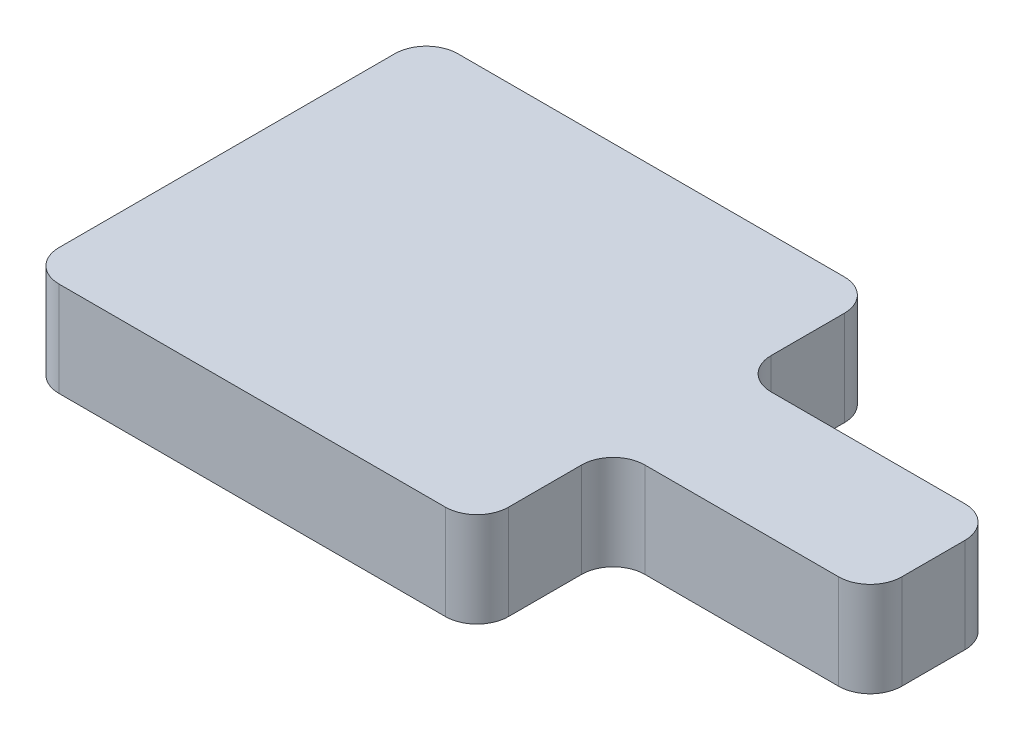
from build123d import *

# Parameters (mm, degrees)
EXTRUDE2_DEPTH = 19.05


with BuildPart() as part:
    # Sketch2 → Extrude2 (new body)
    with BuildSketch(Plane(origin=(0, 0, 0), x_dir=(1, 0, 0), z_dir=(0, 1, 0))):
        with BuildLine():
            Line((0, 6.35), (0, 73.810967782))
            ThreePointArc((0, 73.810967782), (1.859871939, 78.301095843), (6.35, 80.160967782))
            Line((6.35, 80.160967782), (83.990365758, 80.160967782))
            ThreePointArc((83.990365758, 80.160967782), (88.480493819, 78.301095843), (90.340365758, 73.810967782))
            Line((90.340365758, 73.810967782), (90.340365758, 59.130483891))
            ThreePointArc((90.340365758, 59.130483891), (92.200237698, 54.640355831), (96.690365758, 52.780483891))
            Line((96.690365758, 52.780483891), (135.628548363, 52.780483891))
            ThreePointArc((135.628548363, 52.780483891), (140.118676423, 50.920611952), (141.978548363, 46.430483891))
            Line((141.978548363, 46.430483891), (141.978548363, 33.730483891))
            ThreePointArc((141.978548363, 33.730483891), (140.118676423, 29.240355831), (135.628548363, 27.380483891))
            Line((135.628548363, 27.380483891), (96.690365758, 27.380483891))
            ThreePointArc((96.690365758, 27.380483891), (92.200237698, 25.520611952), (90.340365758, 21.030483891))
            Line((90.340365758, 21.030483891), (90.340365758, 6.35))
            ThreePointArc((90.340365758, 6.35), (88.480493819, 1.859871939), (83.990365758, 0))
            Line((83.990365758, 0), (6.35, 0))
            ThreePointArc((6.35, 0), (1.859871939, 1.859871939), (0, 6.35))
        make_face()
    extrude(amount=-EXTRUDE2_DEPTH)


solid = part.part
